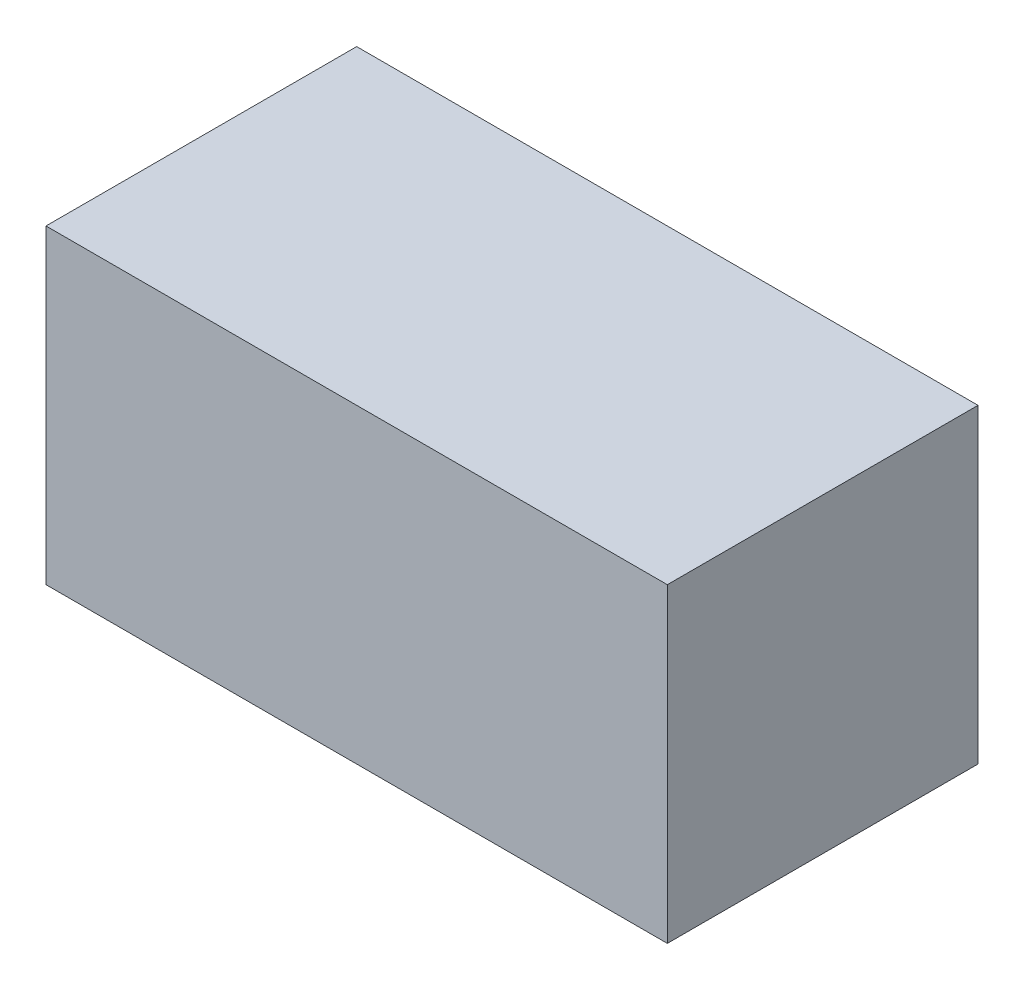
from build123d import *

# Parameters (mm, degrees)
SKETCH1_W           = 50
SKETCH1_H           = 25
BOSS_EXTRUDE1_DEPTH = 25


with BuildPart() as part:
    # Sketch1 → Boss-Extrude1 (new body)
    with BuildSketch(Plane(origin=(0, 0, 0), x_dir=(1, 0, 0), z_dir=(0, 1, 0))):
        Rectangle(SKETCH1_W, SKETCH1_H)
    extrude(amount=BOSS_EXTRUDE1_DEPTH)


solid = part.part
